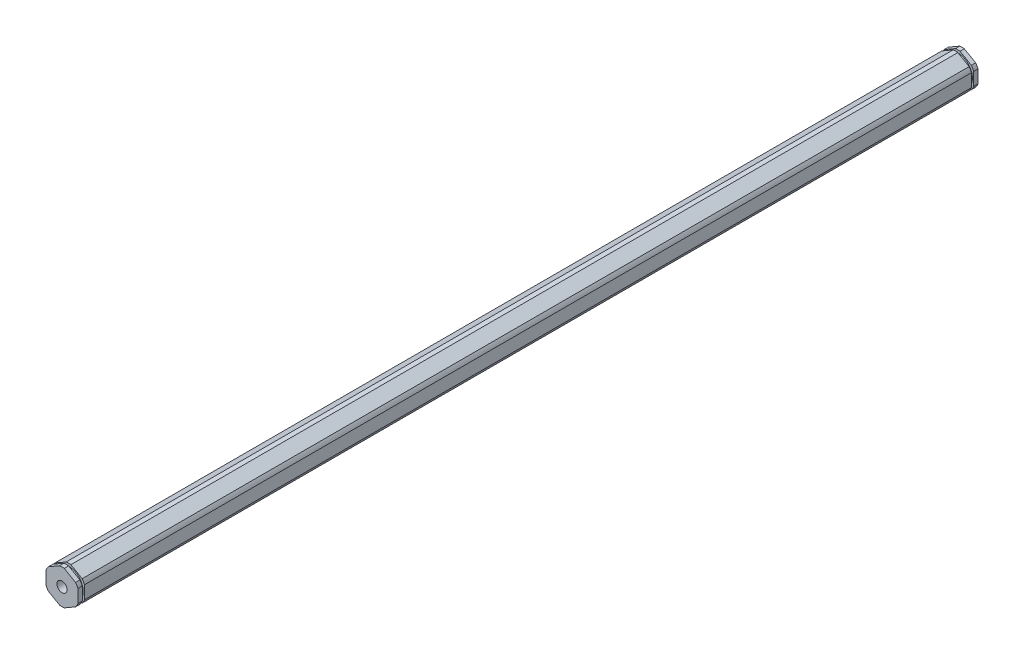
from build123d import *

# Parameters (mm, degrees)
BOSS_EXTRUDE1_DEPTH                  = 178.8795
F_10_32_TAPPED_HOLE1_D               = 4.0386
F_10_32_TAPPED_HOLE1_DEPTH           = 16.34744
F_10_32_TAPPED_HOLE1_TIP             = 1.213317848
F_10_32_TAPPED_HOLE1_ON_FACE_2_D     = 4.0386
F_10_32_TAPPED_HOLE1_ON_FACE_2_DEPTH = 16.34744
F_10_32_TAPPED_HOLE1_ON_FACE_2_TIP   = 1.213317848
SKETCH5_W                            = 0.889
SKETCH5_H                            = 1.0033


with BuildPart() as part:
    # Sketch1 → Boss-Extrude1 (new, symmetric)
    with BuildSketch(Plane.XY):
        with BuildLine():
            ThreePointArc((0.93173274, 6.79441227), (0, 6.858), (-0.93173274, 6.79441227))
            Line((-0.93173274, 6.79441227), (-5.41826726, 4.204110358))
            ThreePointArc((-5.41826726, 4.204110358), (-5.939202219, 3.429), (-6.35, 2.590301913))
            Line((-6.35, 2.590301913), (-6.35, -2.590301913))
            ThreePointArc((-6.35, -2.590301913), (-5.939202219, -3.429), (-5.41826726, -4.204110358))
            Line((-5.41826726, -4.204110358), (-0.93173274, -6.79441227))
            ThreePointArc((-0.93173274, -6.79441227), (0, -6.858), (0.93173274, -6.79441227))
            Line((0.93173274, -6.79441227), (5.41826726, -4.204110358))
            ThreePointArc((5.41826726, -4.204110358), (5.939202219, -3.429), (6.35, -2.590301913))
            Line((6.35, -2.590301913), (6.35, 2.590301913))
            ThreePointArc((6.35, 2.590301913), (5.939202219, 3.429), (5.41826726, 4.204110358))
            Line((5.41826726, 4.204110358), (0.93173274, 6.79441227))
        make_face()
    extrude(amount=BOSS_EXTRUDE1_DEPTH, both=True)

    # #10-32 Tapped Hole1
    with Locations(Plane.XY.offset(178.8795)):
        with Locations((0, 0)):
            Hole(F_10_32_TAPPED_HOLE1_D / 2, depth=F_10_32_TAPPED_HOLE1_DEPTH)
            with Locations((0, 0, -(F_10_32_TAPPED_HOLE1_DEPTH + F_10_32_TAPPED_HOLE1_TIP / 2))):  # 118° drill point
                Cone(0, F_10_32_TAPPED_HOLE1_D / 2, F_10_32_TAPPED_HOLE1_TIP, mode=Mode.SUBTRACT)

    # #10-32 Tapped Hole1 on face 2
    with Locations(Plane(origin=(0, 0, -178.8795), x_dir=(-1, 0, 0), z_dir=(0, 0, -1))):
        with Locations((0, 0)):
            Hole(F_10_32_TAPPED_HOLE1_ON_FACE_2_D / 2, depth=F_10_32_TAPPED_HOLE1_ON_FACE_2_DEPTH)
            with Locations((0, 0, -(F_10_32_TAPPED_HOLE1_ON_FACE_2_DEPTH + F_10_32_TAPPED_HOLE1_ON_FACE_2_TIP / 2))):  # 118° drill point
                Cone(0, F_10_32_TAPPED_HOLE1_ON_FACE_2_D / 2, F_10_32_TAPPED_HOLE1_ON_FACE_2_TIP, mode=Mode.SUBTRACT)

    # Sketch5 → Cut-Revolve1 (revolve, cut)
    with BuildSketch(Plane(origin=(0, 0, 0), x_dir=(0, 0, -1), z_dir=(1, 0, 0)), mode=Mode.PRIVATE) as cut_revolve1_sk:
        with Locations((-176.7205, 6.35635)):
            Rectangle(SKETCH5_W, SKETCH5_H)
    cut_revolve1 = revolve(cut_revolve1_sk.sketch.rotate(Axis((0, 0, 165.047176272), (0, 0, -1)), 90), axis=Axis((0, 0, 165.047176272), (0, 0, -1)), mode=Mode.SUBTRACT)

    # Mirror1: Cut-Revolve1 across plane
    add(cut_revolve1.mirror(Plane.XY), mode=Mode.SUBTRACT)


solid = part.part
